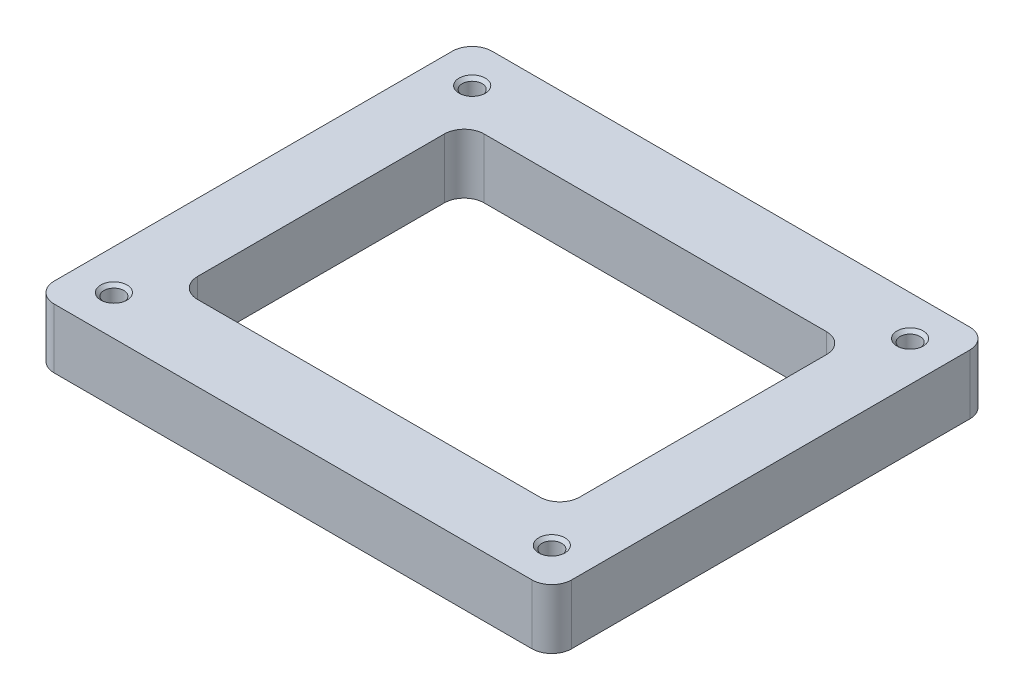
from build123d import *

# Parameters (mm, degrees)
SKETCH1_W           = 82.55
SKETCH1_H           = 69.85
BOSS_EXTRUDE1_DEPTH = 9.525
SKETCH2_W           = 30.48
SKETCH2_H           = 22.86
CUT_EXTRUDE1_DEPTH  = 71.120815038
SKETCH5_R           = 1.5875
CUT_EXTRUDE2_DEPTH  = 71.120815038
FILLET1_R           = 3.175
CHAMFER1_SIZE       = 0.508


with BuildPart() as part:
    # Sketch1 → Boss-Extrude1 (new body)
    with BuildSketch(Plane(origin=(0, 0, 0), x_dir=(1, 0, 0), z_dir=(0, 1, 0))):
        with Locations((-6.44460094, 15.563045741)):
            Rectangle(SKETCH1_W, SKETCH1_H)
    extrude(amount=BOSS_EXTRUDE1_DEPTH)

    # Sketch2 → Cut-Extrude1 (cut, through all)
    with BuildSketch(Plane(origin=(0, 9.525, 0), x_dir=(1, 0, 0), z_dir=(0, 1, 0))):
        with Locations((-21.68460094, 26.993045741)):
            Rectangle(SKETCH2_W, SKETCH2_H)
        with Locations((8.79539906, 26.993045741)):
            Rectangle(SKETCH2_W, SKETCH2_H)
        with Locations((8.79539906, 4.133045741)):
            Rectangle(SKETCH2_W, SKETCH2_H)
        with Locations((-21.68460094, 4.133045741)):
            Rectangle(SKETCH2_W, SKETCH2_H)
    extrude(amount=-CUT_EXTRUDE1_DEPTH, mode=Mode.SUBTRACT)

    # Sketch5 → Cut-Extrude2 (cut, through all)
    with BuildSketch(Plane(origin=(0, 9.525, 0), x_dir=(1, 0, 0), z_dir=(0, 1, 0))):
        with Locations(Location((-41.36960094, 44.138045741, 0), (0, 0, 270))):
            Circle(SKETCH5_R)
        with Locations(Location((28.48039906, 44.138045741, 0), (0, 0, 270))):
            Circle(SKETCH5_R)
        with Locations(Location((28.48039906, -13.011954259, 0), (0, 0, 270))):
            Circle(SKETCH5_R)
        with Locations(Location((-41.36960094, -13.011954259, 0), (0, 0, 270))):
            Circle(SKETCH5_R)
    extrude(amount=-CUT_EXTRUDE2_DEPTH, mode=Mode.SUBTRACT)

    # Fillet1
    fillet1_edges = [part.edges().sort_by_distance(p)[0] for p in [
        (24.03539906, 4.7625, 7.296954259),
        (-36.92460094, 4.7625, 7.296954259),
        (-36.92460094, 4.7625, -38.423045741),
        (24.03539906, 4.7625, -38.423045741),
        (-47.71960094, 4.7625, -50.488045741),
        (34.83039906, 4.7625, -50.488045741),
        (34.83039906, 4.7625, 19.361954259),
        (-47.71960094, 4.7625, 19.361954259),
    ]]
    fillet(fillet1_edges, radius=FILLET1_R)

    # Chamfer1
    chamfer1_edges = [part.edges().sort_by_distance(p)[0] for p in [
        (-41.36960094, 9.525, 11.424454259),
        (28.48039906, 9.525, 11.424454259),
        (28.48039906, 9.525, -45.725545741),
        (-41.36960094, 9.525, -45.725545741),
    ]]
    chamfer(chamfer1_edges, length=CHAMFER1_SIZE)


solid = part.part
